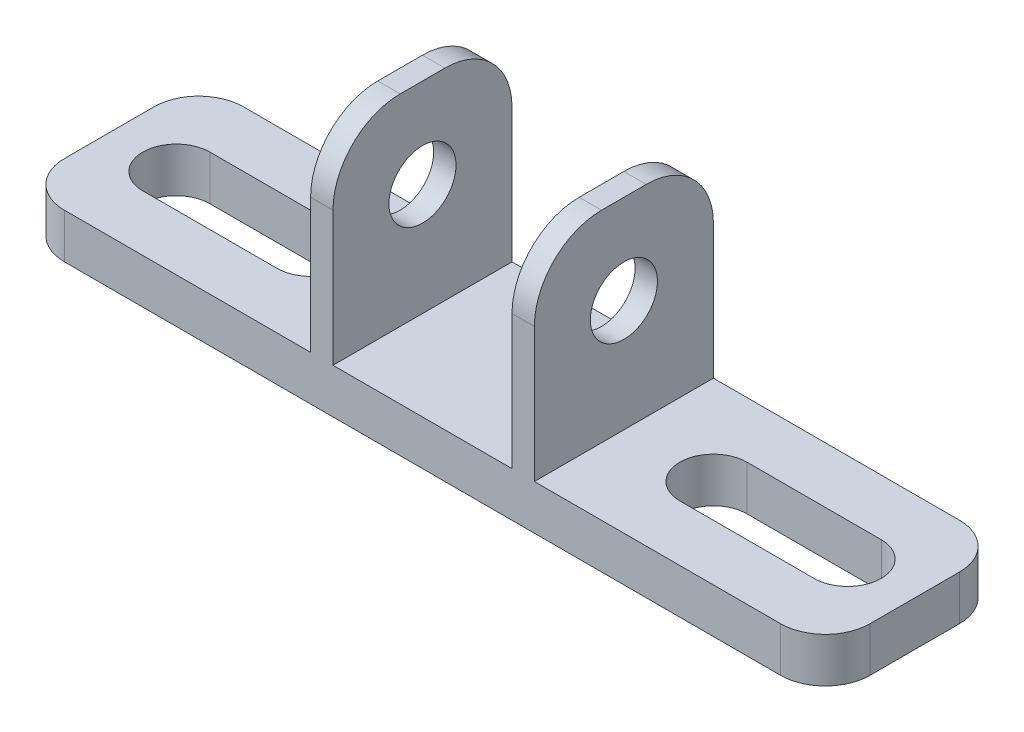
from build123d import *

# Parameters (mm, degrees)
EXTRUDE_1_DEPTH     = 2
SKETCH_2_W          = 1
SKETCH_2_H          = 8
EXTRUDE_2_DEPTH     = 9
FILLET_2_R          = 3
SKETCH_3_R          = 1.5
CUT_EXTRUDE_1_DEPTH = 20


with BuildPart() as part:
    # 草图1 → 凸台-拉伸1 (new body)
    with BuildSketch(Plane(origin=(0, 0, 0), x_dir=(1, 0, 0), z_dir=(0, 1, 0))):
        with BuildLine():
            Line((-16, 4), (16, 4))
            ThreePointArc((16, 4), (17.414213562, 3.414213562), (18, 2))
            Line((18, 2), (18, -2))
            ThreePointArc((18, -2), (17.414213562, -3.414213562), (16, -4))
            Line((16, -4), (-16, -4))
            ThreePointArc((-16, -4), (-17.414213562, -3.414213562), (-18, -2))
            Line((-18, -2), (-18, 2))
            ThreePointArc((-18, 2), (-17.414213562, 3.414213562), (-16, 4))
        make_face()
        with BuildLine():
            Line((-9, -1.5), (-15, -1.5))
            ThreePointArc((-15, -1.5), (-16.5, 0), (-15, 1.5))
            Line((-15, 1.5), (-9, 1.5))
            ThreePointArc((-9, 1.5), (-7.5, 0), (-9, -1.5))
        make_face(mode=Mode.SUBTRACT)
        with BuildLine():
            Line((9, 1.5), (15, 1.5))
            ThreePointArc((15, 1.5), (16.5, 0), (15, -1.5))
            Line((15, -1.5), (9, -1.5))
            ThreePointArc((9, -1.5), (7.5, 0), (9, 1.5))
        make_face(mode=Mode.SUBTRACT)
    extrude(amount=EXTRUDE_1_DEPTH)

    # 草图2 → 凸台-拉伸2 (add)
    with BuildSketch(Plane(origin=(0, 2, 0), x_dir=(1, 0, 0), z_dir=(0, 1, 0))):
        with Locations((4.5, 0)):
            Rectangle(SKETCH_2_W, SKETCH_2_H)
        with Locations((-4.5, 0)):
            Rectangle(SKETCH_2_W, SKETCH_2_H)
    extrude(amount=EXTRUDE_2_DEPTH)

    # 圆角2
    fillet_2_edges = [part.edges().sort_by_distance(p)[0] for p in [
        (4.5, 11, -4),
        (4.5, 11, 4),
        (-4.5, 11, -4),
        (-4.5, 11, 4),
    ]]
    fillet(fillet_2_edges, radius=FILLET_2_R)

    # 草图3 → 切除-拉伸1 (cut)
    with BuildSketch(Plane.ZY.offset(5)):
        with Locations((0, 7)):
            Circle(SKETCH_3_R)
    extrude(amount=-CUT_EXTRUDE_1_DEPTH, mode=Mode.SUBTRACT)


solid = part.part
